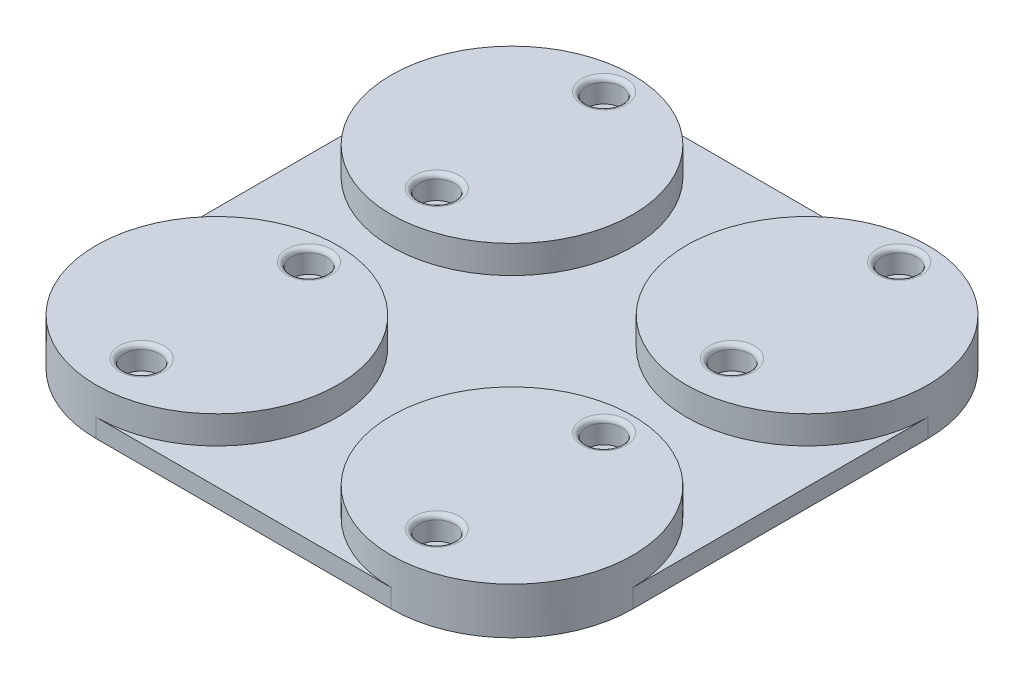
from build123d import *

# Parameters (mm, degrees)
SKETCH1_R           = 13
BOSS_EXTRUDE1_DEPTH = 3
SKETCH2_R           = 1.905
CUT_EXTRUDE1_DEPTH  = 2.5
LPATTERN5_COUNT     = 2
LPATTERN5_PITCH     = 31.75
LPATTERN5_2_COUNT   = 2
LPATTERN5_2_PITCH   = 31.75
BOSS_EXTRUDE2_START = 2
BOSS_EXTRUDE2_DEPTH = 2
SKETCH5_W           = 1.346153846
SKETCH5_H           = 0.358974359
CUT_EXTRUDE2_DEPTH  = 0.25
FILLET1_R           = 0.5


with BuildPart() as part:
    # Sketch1 → Boss-Extrude1 (new body)
    with BuildSketch(Plane(origin=(0, 0, 0), x_dir=(1, 0, 0), z_dir=(0, 1, 0))):
        with Locations(Location((0, 0, 0), (0, 0, 270))):
            Circle(SKETCH1_R)
    extrude(amount=BOSS_EXTRUDE1_DEPTH)

    # Sketch2 → Cut-Extrude1 (cut)
    with BuildSketch(Plane(origin=(0, 3, 0), x_dir=(1, 0, 0), z_dir=(0, 1, 0))):
        with Locations(Location((0, 9.906, 0), (0, 0, 270))):
            Circle(SKETCH2_R)
        with Locations(Location((0, -8.094, 0), (0, 0, 270))):
            Circle(SKETCH2_R)
    extrude(amount=-CUT_EXTRUDE1_DEPTH, mode=Mode.SUBTRACT)


with BuildPart() as lpattern5_1:
    # LPattern5: pattern copy
    add(part.part.moved(Location(Vector(0, 0, 1) * (1 * LPATTERN5_PITCH))))


with BuildPart() as lpattern5_2_1:
    # LPattern5 2: pattern copy
    add(part.part.moved(Location(Vector(1, 0, 0) * (1 * LPATTERN5_2_PITCH))))


with BuildPart() as lpattern5_2_2:
    # LPattern5 2: pattern copy
    add(lpattern5_1.part.moved(Location(Vector(1, 0, 0) * (1 * LPATTERN5_2_PITCH))))


with BuildPart() as part_1:
    add(part.part)

    add(lpattern5_1.part)  # Boss-Extrude2 merges LPattern5_1

    add(lpattern5_2_1.part)  # Boss-Extrude2 merges LPattern5 2_1

    add(lpattern5_2_2.part)  # Boss-Extrude2 merges LPattern5 2_2
    # Sketch3 → Boss-Extrude2 (add)
    with BuildSketch(Plane.XZ.offset(BOSS_EXTRUDE2_START)):
        with BuildLine():
            Line((-13, 0), (-13, 31.75))
            ThreePointArc((-13, 31.75), (-9.192388155, 40.942388155), (0, 44.75))
            Line((0, 44.75), (31.75, 44.75))
            ThreePointArc((31.75, 44.75), (40.942388155, 40.942388155), (44.75, 31.75))
            Line((44.75, 31.75), (44.75, 0))
            ThreePointArc((44.75, 0), (40.942388155, -9.192388155), (31.75, -13))
            Line((31.75, -13), (0, -13))
            ThreePointArc((0, -13), (-9.192388155, -9.192388155), (-13, 0))
        make_face()
    extrude(amount=-BOSS_EXTRUDE2_DEPTH)

    # Sketch5 → Cut-Extrude2 (cut)
    # profile 1 of 16: a face of its own
    with BuildSketch(Plane.XZ.offset(2)):
        with BuildLine():
            Line((0.448717949, 3.5), (1.149138622, 3.5))
            add(Edge.make_bspline(
                [(1.149138622, 3.5), (1.19587975, 3.499844414), (1.285627895, 3.499545672), (1.414201165, 3.497879909), (1.531028262, 3.493105553), (1.636048101, 3.48899697), (1.729258756, 3.481505028), (1.810946047, 3.474344381), (1.880733745, 3.46497072), (1.922979596, 3.456265297), (1.942107372, 3.452323718)],
                knots=[0, 0, 0, 0, 1.410062039, 2.707475311, 3.878576406, 4.937260626, 5.877586885, 6.699081471, 7.410979367, 8, 8, 8, 8], degree=3))
            add(Edge.make_bspline(
                [(1.942107372, 3.452323718), (1.967713996, 3.445996953), (2.018380985, 3.433478389), (2.091331051, 3.407018788), (2.160845375, 3.376399163), (2.2266352, 3.340435443), (2.288370991, 3.298860663), (2.346689302, 3.252392541), (2.401854765, 3.201285335), (2.451636395, 3.144250494), (2.498575447, 3.084413984), (2.538164073, 3.019710227), (2.572290553, 2.9520487), (2.59946107, 2.880741282), (2.621339044, 2.80647951), (2.636765283, 2.728590713), (2.646016471, 2.647429738), (2.646958326, 2.59207183), (2.647435897, 2.564002404)],
                knots=[0, 0, 0, 0, 1.027469482, 2.033020251, 3.019912614, 3.986113645, 4.951240523, 5.91722682, 6.890402269, 7.87763091, 8.8651537, 9.85103654, 10.82876324, 11.815024772, 12.821070561, 13.842952187, 14.906261191, 16, 16, 16, 16], degree=3))
            add(Edge.make_bspline(
                [(2.647435897, 2.564002404), (2.645966899, 2.517367299), (2.643100504, 2.426370131), (2.6163754, 2.29430925), (2.57259888, 2.171119935), (2.512275591, 2.056957297), (2.435456115, 1.954046652), (2.343131324, 1.863656197), (2.235249713, 1.788016284), (2.134820397, 1.735563479), (2.046106197, 1.701970571), (1.973072884, 1.678334212), (1.893405907, 1.660072247), (1.807868572, 1.643712115), (1.716104917, 1.63136042), (1.618334877, 1.622313826), (1.514488726, 1.616659777), (1.443149656, 1.615817772), (1.406450321, 1.615384615)],
                knots=[0, 0, 0, 0, 1.260483769, 2.459530307, 3.627416485, 4.787058657, 5.939039949, 7.08810263, 8.267026773, 9.491475466, 10.141966685, 10.831826277, 11.566392101, 12.351337768, 13.187381173, 14.07005841, 15.007169909, 16, 16, 16, 16], degree=3))
            Line((1.406450321, 1.615384615), (2.692307692, 0))
            Line((2.692307692, 0), (2.303886218, 0))
            Line((2.303886218, 0), (1.018028846, 1.615384615))
            Line((1.018028846, 1.615384615), (0.762820513, 1.615384615))
            Line((0.762820513, 1.615384615), (0.762820513, 0))
            Line((0.762820513, 0), (0.448717949, 0))
            Line((0.448717949, 0), (0.448717949, 3.5))
        make_face()
        with BuildLine():
            Line((0.762820513, 3.141025641), (0.762820513, 1.974358974))
            Line((0.762820513, 1.974358974), (1.403645833, 1.969451122))
            add(Edge.make_bspline(
                [(1.403645833, 1.969451122), (1.433565872, 1.969437885), (1.491559429, 1.969412229), (1.575460094, 1.973406005), (1.653580206, 1.977949323), (1.725620958, 1.984898669), (1.791614533, 1.99385474), (1.851527947, 2.005057725), (1.905458998, 2.018109787), (1.968357537, 2.038311413), (2.038594068, 2.070317431), (2.114925528, 2.11688293), (2.179927866, 2.175452049), (2.234845728, 2.242425505), (2.27897516, 2.316061754), (2.310087214, 2.395478123), (2.329829656, 2.478669721), (2.332158202, 2.535847829), (2.333333333, 2.564703526)],
                knots=[0, 0, 0, 0, 1.146690395, 2.22261258, 3.21895312, 4.145990853, 4.996080663, 5.770904154, 6.481378293, 7.121626537, 8.300444488, 9.431385265, 10.535395872, 11.636531494, 12.74115979, 13.810798291, 14.895190096, 16, 16, 16, 16], degree=3))
            add(Edge.make_bspline(
                [(2.333333333, 2.564703526), (2.332131212, 2.592850099), (2.329749047, 2.648626338), (2.310300278, 2.730282248), (2.277410897, 2.807349198), (2.233088659, 2.879513683), (2.179089504, 2.945019419), (2.115771691, 3.001066572), (2.044866496, 3.047316037), (1.978595298, 3.076870418), (1.919361085, 3.094990271), (1.867931425, 3.107741435), (1.809819948, 3.117985904), (1.744744489, 3.126193964), (1.672982858, 3.133248909), (1.594172207, 3.138000687), (1.508835427, 3.140814551), (1.449688496, 3.14095364), (1.419070513, 3.141025641)],
                knots=[0, 0, 0, 0, 1.101028733, 2.181837193, 3.264309656, 4.369019818, 5.486613113, 6.575447106, 7.666700264, 8.788928104, 9.402425223, 10.0903467, 10.862060571, 11.710948788, 12.657782767, 13.684531032, 14.801375019, 16, 16, 16, 16], degree=3))
            Line((1.419070513, 3.141025641), (0.762820513, 3.141025641))
        make_face(mode=Mode.SUBTRACT)
    # profile 2 of 16: a face of its own
    with BuildSketch(Plane.XZ.offset(2)):
        with BuildLine():
            add(Edge.make_bspline(
                [(4.555889423, 2.602564103), (4.603880696, 2.601542211), (4.697979853, 2.599538533), (4.835787739, 2.578123567), (4.967332875, 2.545376203), (5.093119067, 2.500104641), (5.211535363, 2.43942269), (5.324306607, 2.367013399), (5.431123616, 2.281230805), (5.495146645, 2.214872737), (5.527644231, 2.181189904)],
                knots=[0, 0, 0, 0, 1.054011418, 2.066658804, 3.057071809, 4.030435133, 4.997543892, 5.974964718, 6.972108034, 8, 8, 8, 8], degree=3))
            add(Edge.make_bspline(
                [(5.527644231, 2.181189904), (5.555626185, 2.148975918), (5.611048565, 2.085171376), (5.682114284, 1.981715763), (5.743335844, 1.874575662), (5.792398805, 1.762328336), (5.831083829, 1.645953664), (5.858549525, 1.525051653), (5.87488646, 1.399889306), (5.877089427, 1.314885468), (5.878205128, 1.271834936)],
                knots=[0, 0, 0, 0, 1.025258237, 2.030674902, 3.01204498, 3.988269485, 4.97094183, 5.956517959, 6.965070386, 8, 8, 8, 8], degree=3))
            add(Edge.make_bspline(
                [(5.878205128, 1.271834936), (5.877223791, 1.228534878), (5.875284623, 1.142971945), (5.856941006, 1.016952579), (5.82840992, 0.894757756), (5.787578082, 0.776899063), (5.735219973, 0.663016235), (5.671329285, 0.553606686), (5.595457668, 0.448454553), (5.509453671, 0.348452714), (5.414401795, 0.2562865), (5.311285647, 0.17595823), (5.202131613, 0.107136706), (5.08548826, 0.05170029), (4.962420773, 0.00799059), (4.832663705, -0.022709427), (4.696418635, -0.04127111), (4.603391413, -0.043654684), (4.555889423, -0.044871795)],
                knots=[0, 0, 0, 0, 0.998656419, 1.973391657, 2.932242238, 3.890759089, 4.846373663, 5.82037756, 6.809684879, 7.83454468, 8.860553229, 9.859544525, 10.845671541, 11.83227036, 12.833544569, 13.85385346, 14.904124723, 16, 16, 16, 16], degree=3))
            add(Edge.make_bspline(
                [(4.555889423, -0.044871795), (4.508154704, -0.043650599), (4.414663844, -0.041258824), (4.277937862, -0.022781541), (4.147948243, 0.007976441), (4.024719644, 0.051843934), (3.907574798, 0.107138478), (3.797788301, 0.175750167), (3.694588385, 0.256310322), (3.599516401, 0.348446259), (3.513517795, 0.448456216), (3.437644787, 0.553606254), (3.373754461, 0.663016348), (3.321396257, 0.776899033), (3.280564444, 0.894757764), (3.252033351, 1.016952577), (3.233689737, 1.142971945), (3.231750568, 1.228534878), (3.230769231, 1.271834936)],
                knots=[0, 0, 0, 0, 1.099876186, 2.154163076, 3.173186993, 4.173200201, 5.163417411, 6.152872554, 7.150605724, 8.17532212, 9.198891216, 10.186952605, 11.159729845, 12.11414092, 13.071450619, 14.029093627, 15.002601286, 16, 16, 16, 16], degree=3))
            add(Edge.make_bspline(
                [(3.230769231, 1.271834936), (3.231892541, 1.314651482), (3.234116503, 1.399420884), (3.250437012, 1.524347945), (3.277795568, 1.645045334), (3.316526965, 1.76097081), (3.366042155, 1.872726246), (3.426403443, 1.980131077), (3.498194076, 2.083118877), (3.553396027, 2.146840957), (3.581330128, 2.179086538)],
                knots=[0, 0, 0, 0, 1.031353054, 2.041901799, 3.029428768, 4.008703097, 4.981709435, 5.96992636, 6.972712378, 8, 8, 8, 8], degree=3))
            add(Edge.make_bspline(
                [(3.581330128, 2.179086538), (3.613778719, 2.213061478), (3.677594583, 2.279879174), (3.784943311, 2.365411698), (3.897437132, 2.439327772), (4.017162058, 2.498803987), (4.142844916, 2.545642505), (4.275064159, 2.57820802), (4.413339674, 2.599461375), (4.507899295, 2.601519553), (4.555889423, 2.602564103)],
                knots=[0, 0, 0, 0, 1.027980169, 2.021703884, 2.998553061, 3.971491411, 4.943284454, 5.930300938, 6.949603206, 8, 8, 8, 8], degree=3))
        make_face()
        with BuildLine():
            add(Edge.make_bspline(
                [(4.554487179, 2.288461538), (4.520549568, 2.287496947), (4.453550439, 2.285592664), (4.354930855, 2.27110876), (4.259990701, 2.248161255), (4.168549857, 2.215557199), (4.080916684, 2.1734583), (3.997007282, 2.12174994), (3.916574842, 2.061116984), (3.841192779, 1.991654312), (3.772010466, 1.915775317), (3.71153249, 1.834926959), (3.660107384, 1.750420612), (3.617267225, 1.662168401), (3.585360036, 1.569275987), (3.562187014, 1.472795356), (3.547716774, 1.37252994), (3.545830395, 1.304368921), (3.544871795, 1.269731571)],
                knots=[0, 0, 0, 0, 1.021534396, 2.016698045, 2.994645724, 3.958388632, 4.93408049, 5.916473867, 6.921342795, 7.962252576, 8.998418191, 10.008913653, 10.997312074, 11.973003931, 12.956656626, 13.948281152, 14.957379055, 16, 16, 16, 16], degree=3))
            add(Edge.make_bspline(
                [(3.544871795, 1.269731571), (3.546478619, 1.224979543), (3.549667863, 1.136155138), (3.575603099, 1.005344015), (3.618989379, 0.879762163), (3.677576659, 0.760145777), (3.750982878, 0.649473499), (3.837469944, 0.550802015), (3.936109645, 0.465616203), (4.045726145, 0.394935358), (4.164080463, 0.338775602), (4.289336784, 0.298976626), (4.419977478, 0.273104934), (4.509258209, 0.270533459), (4.554487179, 0.269230769)],
                knots=[0, 0, 0, 0, 1.016792936, 2.018143844, 3.017858371, 4.030088057, 5.03801393, 6.028138512, 7.003788237, 7.991172063, 8.984598303, 9.972568034, 10.972917682, 12, 12, 12, 12], degree=3))
            add(Edge.make_bspline(
                [(4.554487179, 0.269230769), (4.599713548, 0.270541049), (4.688989144, 0.273127506), (4.819448321, 0.298846326), (4.944362293, 0.338949987), (5.062593681, 0.394872197), (5.172160284, 0.465884611), (5.271509405, 0.550320988), (5.357258017, 0.64973484), (5.430591621, 0.760292369), (5.490138364, 0.879576721), (5.533321566, 1.005367193), (5.559319152, 1.136149235), (5.562499981, 1.224977566), (5.564102564, 1.269731571)],
                knots=[0, 0, 0, 0, 1.02726834, 2.027799167, 3.010890988, 4.004497153, 4.992059811, 5.971914811, 6.958719428, 7.966827853, 8.981595046, 9.981490638, 10.983022906, 12, 12, 12, 12], degree=3))
            add(Edge.make_bspline(
                [(5.564102564, 1.269731571), (5.563144294, 1.304369128), (5.561258565, 1.372530554), (5.546783601, 1.472793007), (5.523628061, 1.569284604), (5.491656444, 1.662136607), (5.44900243, 1.750649112), (5.396585637, 1.834678839), (5.336354611, 1.916055385), (5.26633749, 1.991409026), (5.191034113, 2.061144062), (5.110569074, 2.121773452), (5.026784096, 2.173231047), (4.939405513, 2.215917288), (4.847952945, 2.247864628), (4.753145816, 2.271241259), (4.654947006, 2.285531456), (4.588187963, 2.287478598), (4.554487179, 2.288461538)],
                knots=[0, 0, 0, 0, 1.042956736, 2.052379634, 3.044323526, 4.02829302, 5.004299113, 5.996692471, 7.007513377, 8.048758398, 9.090003419, 10.095195979, 11.07790575, 12.047570684, 13.018257071, 13.989683339, 14.985167495, 16, 16, 16, 16], degree=3))
        make_face(mode=Mode.SUBTRACT)
    # profile 3 of 16: a face of its own
    with BuildSketch(Plane.XZ.offset(2)):
        Polygon((6.820512821, 3.58974359), (7.134615385, 3.58974359), (7.134615385, 2.557692308), (7.583333333, 2.557692308), (7.583333333, 2.243589744), (7.134615385, 2.243589744), (7.134615385, 0), (6.820512821, 0), (6.820512821, 2.243589744), (6.371794872, 2.243589744), (6.371794872, 2.557692308), (6.820512821, 2.557692308), align=None)
    # profile 4 of 16: a face of its own
    with BuildSketch(Plane.XZ.offset(2)):
        with BuildLine():
            add(Edge.make_bspline(
                [(9.357171474, 2.602564103), (9.405162747, 2.601542211), (9.499261905, 2.599538533), (9.637069791, 2.578123567), (9.768614927, 2.545376203), (9.894401119, 2.500104641), (10.012817414, 2.43942269), (10.125588658, 2.367013399), (10.232405667, 2.281230805), (10.296428696, 2.214872737), (10.328926282, 2.181189904)],
                knots=[0, 0, 0, 0, 1.054011418, 2.066658804, 3.057071809, 4.030435133, 4.997543892, 5.974964718, 6.972108034, 8, 8, 8, 8], degree=3))
            add(Edge.make_bspline(
                [(10.328926282, 2.181189904), (10.356908236, 2.148975918), (10.412330616, 2.085171376), (10.483396335, 1.981715763), (10.544617895, 1.874575662), (10.593680856, 1.762328336), (10.63236588, 1.645953664), (10.659831576, 1.525051653), (10.676168511, 1.399889306), (10.678371478, 1.314885468), (10.679487179, 1.271834936)],
                knots=[0, 0, 0, 0, 1.025258237, 2.030674902, 3.01204498, 3.988269485, 4.97094183, 5.956517959, 6.965070386, 8, 8, 8, 8], degree=3))
            add(Edge.make_bspline(
                [(10.679487179, 1.271834936), (10.678505842, 1.228534878), (10.676566674, 1.142971945), (10.658223057, 1.016952579), (10.629691972, 0.894757756), (10.588860133, 0.776899063), (10.536502024, 0.663016235), (10.472611337, 0.553606686), (10.396739719, 0.448454553), (10.310735723, 0.348452714), (10.215683847, 0.2562865), (10.112567698, 0.17595823), (10.003413664, 0.107136706), (9.886770311, 0.05170029), (9.763702824, 0.00799059), (9.633945756, -0.022709427), (9.497700686, -0.04127111), (9.404673465, -0.043654684), (9.357171474, -0.044871795)],
                knots=[0, 0, 0, 0, 0.998656419, 1.973391657, 2.932242238, 3.890759089, 4.846373663, 5.82037756, 6.809684879, 7.83454468, 8.860553229, 9.859544525, 10.845671541, 11.83227036, 12.833544569, 13.85385346, 14.904124723, 16, 16, 16, 16], degree=3))
            add(Edge.make_bspline(
                [(9.357171474, -0.044871795), (9.309436755, -0.043650599), (9.215945895, -0.041258824), (9.079219913, -0.022781541), (8.949230294, 0.007976441), (8.826001696, 0.051843934), (8.708856849, 0.107138478), (8.599070352, 0.175750167), (8.495870436, 0.256310322), (8.400798452, 0.348446259), (8.314799847, 0.448456216), (8.238926838, 0.553606254), (8.175036512, 0.663016348), (8.122678308, 0.776899033), (8.081846495, 0.894757764), (8.053315403, 1.016952577), (8.034971788, 1.142971945), (8.033032619, 1.228534878), (8.032051282, 1.271834936)],
                knots=[0, 0, 0, 0, 1.099876186, 2.154163076, 3.173186993, 4.173200201, 5.163417411, 6.152872554, 7.150605724, 8.17532212, 9.198891216, 10.186952605, 11.159729845, 12.11414092, 13.071450619, 14.029093627, 15.002601286, 16, 16, 16, 16], degree=3))
            add(Edge.make_bspline(
                [(8.032051282, 1.271834936), (8.033174592, 1.314651482), (8.035398554, 1.399420884), (8.051719063, 1.524347945), (8.079077619, 1.645045334), (8.117809016, 1.76097081), (8.167324207, 1.872726246), (8.227685495, 1.980131077), (8.299476127, 2.083118877), (8.354678079, 2.146840957), (8.382612179, 2.179086538)],
                knots=[0, 0, 0, 0, 1.031353054, 2.041901799, 3.029428768, 4.008703097, 4.981709435, 5.96992636, 6.972712378, 8, 8, 8, 8], degree=3))
            add(Edge.make_bspline(
                [(8.382612179, 2.179086538), (8.415060771, 2.213061478), (8.478876634, 2.279879174), (8.586225362, 2.365411698), (8.698719183, 2.439327772), (8.818444109, 2.498803987), (8.944126967, 2.545642505), (9.07634621, 2.57820802), (9.214621725, 2.599461375), (9.309181346, 2.601519553), (9.357171474, 2.602564103)],
                knots=[0, 0, 0, 0, 1.027980169, 2.021703884, 2.998553061, 3.971491411, 4.943284454, 5.930300938, 6.949603206, 8, 8, 8, 8], degree=3))
        make_face()
        with BuildLine():
            add(Edge.make_bspline(
                [(9.355769231, 2.288461538), (9.321831619, 2.287496947), (9.254832491, 2.285592664), (9.156212906, 2.27110876), (9.061272752, 2.248161255), (8.969831908, 2.215557199), (8.882198736, 2.1734583), (8.798289333, 2.12174994), (8.717856893, 2.061116984), (8.64247483, 1.991654312), (8.573292518, 1.915775317), (8.512814541, 1.834926959), (8.461389435, 1.750420612), (8.418549276, 1.662168401), (8.386642088, 1.569275987), (8.363469065, 1.472795356), (8.348998825, 1.37252994), (8.347112446, 1.304368921), (8.346153846, 1.269731571)],
                knots=[0, 0, 0, 0, 1.021534396, 2.016698045, 2.994645724, 3.958388632, 4.93408049, 5.916473867, 6.921342795, 7.962252576, 8.998418191, 10.008913653, 10.997312074, 11.973003931, 12.956656626, 13.948281152, 14.957379055, 16, 16, 16, 16], degree=3))
            add(Edge.make_bspline(
                [(8.346153846, 1.269731571), (8.34776067, 1.224979543), (8.350949914, 1.136155138), (8.376885151, 1.005344015), (8.420271431, 0.879762163), (8.47885871, 0.760145777), (8.552264929, 0.649473499), (8.638751996, 0.550802015), (8.737391696, 0.465616203), (8.847008196, 0.394935358), (8.965362514, 0.338775602), (9.090618835, 0.298976626), (9.221259529, 0.273104934), (9.31054026, 0.270533459), (9.355769231, 0.269230769)],
                knots=[0, 0, 0, 0, 1.016792936, 2.018143844, 3.017858371, 4.030088057, 5.03801393, 6.028138512, 7.003788237, 7.991172063, 8.984598303, 9.972568034, 10.972917682, 12, 12, 12, 12], degree=3))
            add(Edge.make_bspline(
                [(9.355769231, 0.269230769), (9.4009956, 0.270541049), (9.490271196, 0.273127506), (9.620730373, 0.298846326), (9.745644344, 0.338949987), (9.863875732, 0.394872197), (9.973442335, 0.465884611), (10.072791457, 0.550320988), (10.158540068, 0.64973484), (10.231873673, 0.760292369), (10.291420415, 0.879576721), (10.334603617, 1.005367193), (10.360601203, 1.136149235), (10.363782032, 1.224977566), (10.365384615, 1.269731571)],
                knots=[0, 0, 0, 0, 1.02726834, 2.027799167, 3.010890988, 4.004497153, 4.992059811, 5.971914811, 6.958719428, 7.966827853, 8.981595046, 9.981490638, 10.983022906, 12, 12, 12, 12], degree=3))
            add(Edge.make_bspline(
                [(10.365384615, 1.269731571), (10.364426345, 1.304369128), (10.362540616, 1.372530554), (10.348065652, 1.472793007), (10.324910112, 1.569284604), (10.292938495, 1.662136607), (10.250284481, 1.750649112), (10.197867688, 1.834678839), (10.137636663, 1.916055385), (10.067619542, 1.991409026), (9.992316164, 2.061144062), (9.911851126, 2.121773452), (9.828066147, 2.173231047), (9.740687564, 2.215917288), (9.649234997, 2.247864628), (9.554427868, 2.271241259), (9.456229058, 2.285531456), (9.389470014, 2.287478598), (9.355769231, 2.288461538)],
                knots=[0, 0, 0, 0, 1.042956736, 2.052379634, 3.044323526, 4.02829302, 5.004299113, 5.996692471, 7.007513377, 8.048758398, 9.090003419, 10.095195979, 11.07790575, 12.047570684, 13.018257071, 13.989683339, 14.985167495, 16, 16, 16, 16], degree=3))
        make_face(mode=Mode.SUBTRACT)
    # profile 5 of 16: a face of its own
    with BuildSketch(Plane.XZ.offset(2)):
        with Locations((11.756410256, 1.346153847)):
            Rectangle(SKETCH5_W, SKETCH5_H)
    # profile 6 of 16: a face of its own
    with BuildSketch(Plane.XZ.offset(2)):
        Polygon((13.012820513, 3.5), (13.326923077, 3.5), (13.326923077, 0.358974359), (14.673076923, 0.358974359), (14.673076923, 0), (13.012820513, 0), align=None)
    # profile 7 of 16: a face of its own
    with BuildSketch(Plane.XZ.offset(2)):
        with BuildLine():
            add(Edge.make_bspline(
                [(16.402043269, 2.602564103), (16.450034542, 2.601542211), (16.5441337, 2.599538533), (16.681941586, 2.578123567), (16.813486721, 2.545376203), (16.939272914, 2.500104641), (17.057689209, 2.43942269), (17.170460453, 2.367013399), (17.277277462, 2.281230805), (17.341300491, 2.214872737), (17.373798077, 2.181189904)],
                knots=[0, 0, 0, 0, 1.054011418, 2.066658804, 3.057071809, 4.030435133, 4.997543892, 5.974964718, 6.972108034, 8, 8, 8, 8], degree=3))
            add(Edge.make_bspline(
                [(17.373798077, 2.181189904), (17.401780031, 2.148975918), (17.457202411, 2.085171376), (17.52826813, 1.981715763), (17.58948969, 1.874575662), (17.638552651, 1.762328336), (17.677237675, 1.645953664), (17.704703371, 1.525051653), (17.721040306, 1.399889306), (17.723243273, 1.314885468), (17.724358974, 1.271834936)],
                knots=[0, 0, 0, 0, 1.025258237, 2.030674902, 3.01204498, 3.988269485, 4.97094183, 5.956517959, 6.965070386, 8, 8, 8, 8], degree=3))
            add(Edge.make_bspline(
                [(17.724358974, 1.271834936), (17.723377637, 1.228534878), (17.721438469, 1.142971945), (17.703094852, 1.016952579), (17.674563766, 0.894757756), (17.633731928, 0.776899063), (17.581373819, 0.663016235), (17.517483131, 0.553606686), (17.441611514, 0.448454553), (17.355607518, 0.348452714), (17.260555641, 0.2562865), (17.157439493, 0.17595823), (17.048285459, 0.107136706), (16.931642106, 0.05170029), (16.808574619, 0.00799059), (16.678817551, -0.022709427), (16.542572481, -0.04127111), (16.449545259, -0.043654684), (16.402043269, -0.044871795)],
                knots=[0, 0, 0, 0, 0.998656419, 1.973391657, 2.932242238, 3.890759089, 4.846373663, 5.82037756, 6.809684879, 7.83454468, 8.860553229, 9.859544525, 10.845671541, 11.83227036, 12.833544569, 13.85385346, 14.904124723, 16, 16, 16, 16], degree=3))
            add(Edge.make_bspline(
                [(16.402043269, -0.044871795), (16.35430855, -0.043650599), (16.26081769, -0.041258824), (16.124091708, -0.022781541), (15.994102089, 0.007976441), (15.870873491, 0.051843934), (15.753728644, 0.107138478), (15.643942147, 0.175750167), (15.540742231, 0.256310322), (15.445670247, 0.348446259), (15.359671641, 0.448456216), (15.283798633, 0.553606254), (15.219908307, 0.663016348), (15.167550103, 0.776899033), (15.12671829, 0.894757764), (15.098187197, 1.016952577), (15.079843583, 1.142971945), (15.077904414, 1.228534878), (15.076923077, 1.271834936)],
                knots=[0, 0, 0, 0, 1.099876186, 2.154163076, 3.173186993, 4.173200201, 5.163417411, 6.152872554, 7.150605724, 8.17532212, 9.198891216, 10.186952605, 11.159729845, 12.11414092, 13.071450619, 14.029093627, 15.002601286, 16, 16, 16, 16], degree=3))
            add(Edge.make_bspline(
                [(15.076923077, 1.271834936), (15.078046387, 1.314651482), (15.080270349, 1.399420884), (15.096590858, 1.524347945), (15.123949414, 1.645045334), (15.162680811, 1.76097081), (15.212196002, 1.872726246), (15.27255729, 1.980131077), (15.344347922, 2.083118877), (15.399549874, 2.146840957), (15.427483974, 2.179086538)],
                knots=[0, 0, 0, 0, 1.031353054, 2.041901799, 3.029428768, 4.008703097, 4.981709435, 5.96992636, 6.972712378, 8, 8, 8, 8], degree=3))
            add(Edge.make_bspline(
                [(15.427483974, 2.179086538), (15.459932565, 2.213061478), (15.523748429, 2.279879174), (15.631097157, 2.365411698), (15.743590978, 2.439327772), (15.863315904, 2.498803987), (15.988998762, 2.545642505), (16.121218005, 2.57820802), (16.25949352, 2.599461375), (16.354053141, 2.601519553), (16.402043269, 2.602564103)],
                knots=[0, 0, 0, 0, 1.027980169, 2.021703884, 2.998553061, 3.971491411, 4.943284454, 5.930300938, 6.949603206, 8, 8, 8, 8], degree=3))
        make_face()
        with BuildLine():
            add(Edge.make_bspline(
                [(16.400641026, 2.288461538), (16.366703414, 2.287496947), (16.299704286, 2.285592664), (16.201084701, 2.27110876), (16.106144547, 2.248161255), (16.014703703, 2.215557199), (15.92707053, 2.1734583), (15.843161128, 2.12174994), (15.762728688, 2.061116984), (15.687346625, 1.991654312), (15.618164313, 1.915775317), (15.557686336, 1.834926959), (15.50626123, 1.750420612), (15.463421071, 1.662168401), (15.431513883, 1.569275987), (15.40834086, 1.472795356), (15.39387062, 1.37252994), (15.391984241, 1.304368921), (15.391025641, 1.269731571)],
                knots=[0, 0, 0, 0, 1.021534396, 2.016698045, 2.994645724, 3.958388632, 4.93408049, 5.916473867, 6.921342795, 7.962252576, 8.998418191, 10.008913653, 10.997312074, 11.973003931, 12.956656626, 13.948281152, 14.957379055, 16, 16, 16, 16], degree=3))
            add(Edge.make_bspline(
                [(15.391025641, 1.269731571), (15.392632465, 1.224979543), (15.395821709, 1.136155138), (15.421756946, 1.005344015), (15.465143225, 0.879762163), (15.523730505, 0.760145777), (15.597136724, 0.649473499), (15.68362379, 0.550802015), (15.782263491, 0.465616203), (15.891879991, 0.394935358), (16.010234309, 0.338775602), (16.13549063, 0.298976626), (16.266131324, 0.273104934), (16.355412055, 0.270533459), (16.400641026, 0.269230769)],
                knots=[0, 0, 0, 0, 1.016792936, 2.018143844, 3.017858371, 4.030088057, 5.03801393, 6.028138512, 7.003788237, 7.991172063, 8.984598303, 9.972568034, 10.972917682, 12, 12, 12, 12], degree=3))
            add(Edge.make_bspline(
                [(16.400641026, 0.269230769), (16.445867395, 0.270541049), (16.535142991, 0.273127506), (16.665602167, 0.298846326), (16.790516139, 0.338949987), (16.908747527, 0.394872197), (17.01831413, 0.465884611), (17.117663252, 0.550320988), (17.203411863, 0.64973484), (17.276745468, 0.760292369), (17.33629221, 0.879576721), (17.379475412, 1.005367193), (17.405472998, 1.136149235), (17.408653827, 1.224977566), (17.41025641, 1.269731571)],
                knots=[0, 0, 0, 0, 1.02726834, 2.027799167, 3.010890988, 4.004497153, 4.992059811, 5.971914811, 6.958719428, 7.966827853, 8.981595046, 9.981490638, 10.983022906, 12, 12, 12, 12], degree=3))
            add(Edge.make_bspline(
                [(17.41025641, 1.269731571), (17.40929814, 1.304369128), (17.407412411, 1.372530554), (17.392937447, 1.472793007), (17.369781907, 1.569284604), (17.33781029, 1.662136607), (17.295156276, 1.750649112), (17.242739483, 1.834678839), (17.182508457, 1.916055385), (17.112491337, 1.991409026), (17.037187959, 2.061144062), (16.956722921, 2.121773452), (16.872937942, 2.173231047), (16.785559359, 2.215917288), (16.694106792, 2.247864628), (16.599299662, 2.271241259), (16.501100853, 2.285531456), (16.434341809, 2.287478598), (16.400641026, 2.288461538)],
                knots=[0, 0, 0, 0, 1.042956736, 2.052379634, 3.044323526, 4.02829302, 5.004299113, 5.996692471, 7.007513377, 8.048758398, 9.090003419, 10.095195979, 11.07790575, 12.047570684, 13.018257071, 13.989683339, 14.985167495, 16, 16, 16, 16], degree=3))
        make_face(mode=Mode.SUBTRACT)
    # profile 8 of 16: a face of its own
    with BuildSketch(Plane.XZ.offset(2)):
        with BuildLine():
            Line((20.865384615, 2.003104968), (20.602463942, 1.83974359))
            add(Edge.make_bspline(
                [(20.602463942, 1.83974359), (20.573634077, 1.875571984), (20.516887382, 1.946094094), (20.418348145, 2.037104027), (20.313336731, 2.115271069), (20.200058683, 2.17897482), (20.078672883, 2.22819627), (19.949658032, 2.263026476), (19.813032527, 2.284730719), (19.719367328, 2.287197555), (19.671374199, 2.288461538)],
                knots=[0, 0, 0, 0, 1.026593902, 2.0206758, 2.988051866, 3.946915611, 4.916868779, 5.907761954, 6.927957743, 8, 8, 8, 8], degree=3))
            add(Edge.make_bspline(
                [(19.671374199, 2.288461538), (19.633015242, 2.287404696), (19.557468319, 2.285323274), (19.446562166, 2.272312781), (19.340919813, 2.248670773), (19.239879104, 2.217519816), (19.144158685, 2.175769526), (19.053507767, 2.12495977), (18.967122277, 2.06590973), (18.887505535, 1.997499184), (18.814676528, 1.923100516), (18.751577614, 1.843346821), (18.696640681, 1.76062693), (18.653534725, 1.672875188), (18.618259554, 1.582099134), (18.595052834, 1.486585279), (18.579588139, 1.387557271), (18.57781881, 1.320038931), (18.576923077, 1.285857372)],
                knots=[0, 0, 0, 0, 1.112346261, 2.190735716, 3.231507886, 4.247384806, 5.251966152, 6.253067467, 7.256802811, 8.280671706, 9.291813951, 10.270744147, 11.225547591, 12.165006084, 13.100104208, 14.043489273, 15.009504848, 16, 16, 16, 16], degree=3))
            add(Edge.make_bspline(
                [(18.576923077, 1.285857372), (18.578702329, 1.241088161), (18.58223686, 1.152152965), (18.609938319, 1.020874863), (18.655282727, 0.893951173), (18.717340577, 0.772283036), (18.795817712, 0.65968888), (18.887990275, 0.558705426), (18.993909358, 0.471289398), (19.112641689, 0.398816873), (19.241399433, 0.340555505), (19.378789537, 0.299048172), (19.523689318, 0.2739958), (19.622896065, 0.270839857), (19.673477564, 0.269230769)],
                knots=[0, 0, 0, 0, 0.966302908, 1.919585723, 2.883856336, 3.870342332, 4.860282998, 5.839159637, 6.814385684, 7.815993281, 8.834850808, 9.858348828, 10.908058873, 12, 12, 12, 12], degree=3))
            add(Edge.make_bspline(
                [(19.673477564, 0.269230769), (19.719832748, 0.270530266), (19.810932987, 0.273084123), (19.944100272, 0.294613087), (20.070880183, 0.32985672), (20.191268213, 0.37900437), (20.305044379, 0.442531886), (20.411473554, 0.520891057), (20.512673493, 0.611827657), (20.572170469, 0.682145629), (20.602463942, 0.717948718)],
                knots=[0, 0, 0, 0, 1.039848629, 2.043578496, 3.018386758, 3.987534228, 4.954977003, 5.934852016, 6.948509513, 8, 8, 8, 8], degree=3))
            Line((20.602463942, 0.717948718), (20.865384615, 0.545472756))
            add(Edge.make_bspline(
                [(20.865384615, 0.545472756), (20.849796913, 0.522582029), (20.818673246, 0.476876553), (20.766645621, 0.412432436), (20.710525789, 0.352110754), (20.650532692, 0.295992364), (20.587449682, 0.242734345), (20.519121773, 0.19488277), (20.447752161, 0.149747947), (20.372503004, 0.109135075), (20.294152306, 0.072628754), (20.212810316, 0.041237583), (20.128830503, 0.014267477), (20.042114127, -0.00716987), (19.952490229, -0.024280708), (19.860190594, -0.03563441), (19.765247013, -0.044109691), (19.701074861, -0.044615558), (19.668569712, -0.044871795)],
                knots=[0, 0, 0, 0, 0.954134338, 1.905101784, 2.851144739, 3.791306361, 4.734911809, 5.6936923, 6.663572882, 7.643865596, 8.638447847, 9.640600242, 10.646758161, 11.676244097, 12.717260333, 13.78922464, 14.880174919, 16, 16, 16, 16], degree=3))
            add(Edge.make_bspline(
                [(19.668569712, -0.044871795), (19.618958828, -0.043980515), (19.521721136, -0.0422336), (19.379398628, -0.023025125), (19.243384961, 0.005932491), (19.113726603, 0.047496225), (18.990403369, 0.101001001), (18.87353025, 0.166357915), (18.763494232, 0.244109705), (18.66138345, 0.332872475), (18.567602003, 0.429113115), (18.487075813, 0.532963033), (18.417230542, 0.640604081), (18.361142999, 0.754413607), (18.316496073, 0.87287898), (18.28599124, 0.99694922), (18.266261503, 1.125601474), (18.263978123, 1.213334356), (18.262820513, 1.2578125)],
                knots=[0, 0, 0, 0, 1.1129367, 2.181364009, 3.217532258, 4.231199276, 5.232079859, 6.230262199, 7.231623845, 8.250719726, 9.263571943, 10.242672461, 11.195837495, 12.138959767, 13.085126421, 14.0317438, 15.002148558, 16, 16, 16, 16], degree=3))
            add(Edge.make_bspline(
                [(18.262820513, 1.2578125), (18.263261529, 1.287990935), (18.264138783, 1.348020822), (18.274200711, 1.437115889), (18.287199184, 1.525024434), (18.309224921, 1.610632153), (18.334665552, 1.695237443), (18.367141084, 1.777820545), (18.405236479, 1.858765217), (18.448488426, 1.937862947), (18.497177171, 2.013812487), (18.551058405, 2.085566151), (18.608102741, 2.153985917), (18.670978853, 2.216709677), (18.737018507, 2.276245869), (18.808090082, 2.331003993), (18.883785934, 2.381144984), (18.962969257, 2.427595999), (19.045593968, 2.468955434), (19.131160638, 2.504588672), (19.219153668, 2.535041248), (19.309713812, 2.559150167), (19.402239985, 2.579367591), (19.497461323, 2.592085437), (19.595013545, 2.60107171), (19.661069568, 2.602062502), (19.694511218, 2.602564103)],
                knots=[0, 0, 0, 0, 0.990994727, 1.971252077, 2.943264845, 3.907940874, 4.872158414, 5.844625996, 6.82015047, 7.809835459, 8.804511986, 9.781214284, 10.756496977, 11.728388426, 12.696359165, 13.676225489, 14.672885716, 15.677705647, 16.690706858, 17.706033469, 18.721040654, 19.747369689, 20.783475414, 21.830280724, 22.901553713, 24, 24, 24, 24], degree=3))
            add(Edge.make_bspline(
                [(19.694511218, 2.602564103), (19.736391326, 2.601642212), (19.819942206, 2.599803037), (19.943882912, 2.584324385), (20.065998106, 2.560987969), (20.18414521, 2.526415139), (20.296891724, 2.484551483), (20.402427174, 2.437538769), (20.498267278, 2.382944165), (20.586194867, 2.323224051), (20.666374385, 2.255863145), (20.739628877, 2.180056188), (20.807460526, 2.096197709), (20.845917238, 2.034391978), (20.865384615, 2.003104968)],
                knots=[0, 0, 0, 0, 1.095225653, 2.184976855, 3.262915854, 4.344593502, 5.400796181, 6.407717688, 7.363229445, 8.282371371, 9.184954523, 10.097238608, 11.036792983, 12, 12, 12, 12], degree=3))
        make_face()
    # profile 9 of 16: a face of its own
    with BuildSketch(Plane.XZ.offset(2)):
        Polygon((21.493589744, 3.58974359), (21.807692308, 3.58974359), (21.807692308, 1.514423077), (22.972255609, 2.557692308), (23.423076923, 2.557692308), (22.072716346, 1.346153846), (23.557692308, 0), (23.106870994, 0), (21.807692308, 1.178585737), (21.807692308, 0), (21.493589744, 0), align=None)
    # profile 10 of 16: a face of its own
    with BuildSketch(Plane.XZ.offset(2)):
        with Locations((24.365384615, 1.346153847)):
            Rectangle(SKETCH5_W, SKETCH5_H)
    # profile 11 of 16: a face of its own
    with BuildSketch(Plane.XZ.offset(2)):
        with BuildLine():
            Line((28.897435897, 2.902644231), (28.628205128, 2.647435897))
            add(Edge.make_bspline(
                [(28.628205128, 2.647435897), (28.57948624, 2.69326676), (28.483210194, 2.783835623), (28.326249951, 2.901346619), (28.162486317, 3.002012719), (27.99277382, 3.083918955), (27.821315266, 3.149271716), (27.65038649, 3.195799856), (27.481740789, 3.225472393), (27.36957357, 3.229020763), (27.314302885, 3.230769231)],
                knots=[0, 0, 0, 0, 1.08915593, 2.152340314, 3.188132944, 4.216796309, 5.218260357, 6.173443236, 7.099959455, 8, 8, 8, 8], degree=3))
            add(Edge.make_bspline(
                [(27.314302885, 3.230769231), (27.280388185, 3.230355625), (27.212646744, 3.229529486), (27.1120248, 3.218985271), (27.012458163, 3.203820406), (26.914134788, 3.181878529), (26.816863502, 3.154069469), (26.72098261, 3.119284006), (26.626313255, 3.078728762), (26.533747174, 3.031866288), (26.44400667, 2.980386442), (26.359249835, 2.923337901), (26.278936436, 2.862549111), (26.20457601, 2.796498132), (26.135740824, 2.725783266), (26.070792452, 2.65171996), (26.012015156, 2.572284742), (25.958923991, 2.488939116), (25.911562373, 2.403146926), (25.869753719, 2.315733937), (25.834656631, 2.226990082), (25.806887176, 2.136804005), (25.783976522, 2.045873415), (25.767858915, 1.953568694), (25.758772192, 1.859791009), (25.757200412, 1.79699375), (25.756410256, 1.765424679)],
                knots=[0, 0, 0, 0, 1.02818874, 2.053710826, 3.065248034, 4.081641283, 5.106893873, 6.131558223, 7.173050175, 8.228653731, 9.27666206, 10.308777013, 11.325269123, 12.329503258, 13.32196095, 14.316845687, 15.314881793, 16.315733098, 17.311955233, 18.285320748, 19.252783886, 20.203351036, 21.145449891, 22.095197417, 23.042428769, 24, 24, 24, 24], degree=3))
            add(Edge.make_bspline(
                [(25.756410256, 1.765424679), (25.757165975, 1.733153862), (25.758675348, 1.668700349), (25.768335667, 1.572506276), (25.786263908, 1.477740874), (25.810231616, 1.384092741), (25.840212432, 1.291401493), (25.877585098, 1.200068983), (25.921850699, 1.110098592), (25.973087251, 1.022300975), (26.029273454, 0.936777951), (26.092216535, 0.85621843), (26.159077119, 0.779549652), (26.232291019, 0.708473889), (26.309510561, 0.641089992), (26.393042837, 0.57925447), (26.481245297, 0.521776247), (26.574252509, 0.469379728), (26.671055292, 0.422571192), (26.770312045, 0.380947296), (26.87233986, 0.346667959), (26.97660255, 0.318729855), (27.082975822, 0.295829557), (27.191999624, 0.281097077), (27.302872333, 0.270406246), (27.377610965, 0.269624576), (27.415264423, 0.269230769)],
                knots=[0, 0, 0, 0, 0.93586088, 1.869166235, 2.799637598, 3.729985548, 4.670839027, 5.622275134, 6.589130586, 7.576015415, 8.568469353, 9.55398029, 10.53834874, 11.515998671, 12.510579167, 13.508179873, 14.527009472, 15.561807829, 16.601455013, 17.643573243, 18.680854198, 19.719860599, 20.772568776, 21.833555941, 22.908541556, 24, 24, 24, 24], degree=3))
            add(Edge.make_bspline(
                [(27.415264423, 0.269230769), (27.46064277, 0.270179346), (27.549750528, 0.272042029), (27.68073697, 0.286542319), (27.806540041, 0.309189112), (27.926806244, 0.342355009), (28.041675265, 0.384658684), (28.151568206, 0.43565407), (28.255619865, 0.49729713), (28.354143038, 0.566870997), (28.444900224, 0.644385829), (28.526754348, 0.728030284), (28.598399837, 0.817398351), (28.660904537, 0.911963666), (28.712613191, 1.012508971), (28.755055986, 1.118541534), (28.787589278, 1.230109046), (28.800944252, 1.307200677), (28.807692308, 1.346153846)],
                knots=[0, 0, 0, 0, 1.13008108, 2.219097802, 3.278683437, 4.311054135, 5.322181354, 6.324827112, 7.324222904, 8.330512327, 9.32562643, 10.293043162, 11.24128371, 12.174520618, 13.111833804, 14.052305215, 15.015860969, 16, 16, 16, 16], degree=3))
            Line((28.807692308, 1.346153846), (27.641025641, 1.346153846))
            Line((27.641025641, 1.346153846), (27.641025641, 1.705128205))
            Line((27.641025641, 1.705128205), (29.121794872, 1.705128205))
            add(Edge.make_bspline(
                [(29.121794872, 1.705128205), (29.120089023, 1.638220716), (29.11675037, 1.507270675), (29.093331454, 1.316300404), (29.055514942, 1.13592871), (29.00385463, 0.965965639), (28.93697935, 0.806652046), (28.855606821, 0.65782618), (28.7584347, 0.520449499), (28.648924259, 0.393400495), (28.526024301, 0.280071283), (28.393055681, 0.180465345), (28.249798713, 0.09656273), (28.096388905, 0.028302067), (27.933328472, -0.024971927), (27.760240092, -0.062743504), (27.577358491, -0.085373467), (27.452021814, -0.088264847), (27.387920673, -0.08974359)],
                knots=[0, 0, 0, 0, 1.140356446, 2.231883559, 3.274166699, 4.278491846, 5.25512956, 6.21435461, 7.1637429, 8.11826594, 9.068280886, 10.0076534, 10.945064095, 11.891975133, 12.864533718, 13.863980011, 14.907571808, 16, 16, 16, 16], degree=3))
            add(Edge.make_bspline(
                [(27.387920673, -0.08974359), (27.348410538, -0.089174469), (27.270483817, -0.088051978), (27.155392889, -0.080074631), (27.043475268, -0.067794054), (26.934747259, -0.049248931), (26.828808917, -0.026534277), (26.726189332, 0.002552442), (26.62649759, 0.036221141), (26.529579605, 0.074516815), (26.436315058, 0.118888472), (26.346288541, 0.168198111), (26.259002415, 0.222191472), (26.17505125, 0.281802318), (26.093997629, 0.346584778), (26.016364185, 0.416668697), (25.941716307, 0.491839816), (25.894955843, 0.545218826), (25.871394231, 0.572115385)],
                knots=[0, 0, 0, 0, 1.107784379, 2.184907829, 3.233506516, 4.263428166, 5.276301166, 6.270063455, 7.25232949, 8.225834625, 9.190232166, 10.146266622, 11.1027726, 12.066435141, 13.031522626, 14.010570082, 14.99756817, 16, 16, 16, 16], degree=3))
            add(Edge.make_bspline(
                [(25.871394231, 0.572115385), (25.837208299, 0.614786038), (25.769403886, 0.699419055), (25.68212573, 0.835018999), (25.607724327, 0.975420859), (25.547356505, 1.121015488), (25.500218418, 1.271666701), (25.466412166, 1.427181992), (25.446604876, 1.587761622), (25.443751339, 1.696426887), (25.442307692, 1.751402244)],
                knots=[0, 0, 0, 0, 1.023165419, 2.029347347, 3.013907458, 3.994755782, 4.975994455, 5.96558838, 6.970761222, 8, 8, 8, 8], degree=3))
            add(Edge.make_bspline(
                [(25.442307692, 1.751402244), (25.44283993, 1.792568496), (25.443897642, 1.874377804), (25.456723158, 1.995835111), (25.475124576, 2.115135803), (25.502171631, 2.23218236), (25.536267896, 2.347052951), (25.578821382, 2.459800915), (25.628366278, 2.570492787), (25.685951774, 2.678366655), (25.750036233, 2.781991068), (25.819586454, 2.880948871), (25.895590054, 2.973437936), (25.976805853, 3.060629584), (26.064202844, 3.141428431), (26.156962267, 3.216582542), (26.25515561, 3.286192728), (26.35909179, 3.349162562), (26.467219475, 3.405726183), (26.579279476, 3.455315395), (26.695237587, 3.49629871), (26.814225065, 3.53107249), (26.937142565, 3.55678763), (27.063098102, 3.575436376), (27.192748214, 3.588196975), (27.280384244, 3.589223231), (27.324819712, 3.58974359)],
                knots=[0, 0, 0, 0, 1.008945113, 2.00506715, 2.99143336, 3.967273523, 4.948097931, 5.927297278, 6.919902385, 7.919676788, 8.923139349, 9.905703106, 10.883022732, 11.856032218, 12.825136022, 13.798837087, 14.781400844, 15.773989409, 16.776158564, 17.77167057, 18.775803737, 19.789618931, 20.80898985, 21.851988756, 22.910860228, 24, 24, 24, 24], degree=3))
            add(Edge.make_bspline(
                [(27.324819712, 3.58974359), (27.361057955, 3.589164098), (27.432914134, 3.588015034), (27.539839866, 3.580050386), (27.645112881, 3.567426505), (27.748889271, 3.550199718), (27.850815637, 3.526736028), (27.951182342, 3.498657743), (28.050134879, 3.46596592), (28.147363128, 3.426977074), (28.243520844, 3.382723449), (28.339142684, 3.332910027), (28.43390193, 3.276685022), (28.527962912, 3.213881487), (28.62191877, 3.145578069), (28.714283412, 3.069821245), (28.807286356, 2.989598489), (28.86708817, 2.931916305), (28.897435897, 2.902644231)],
                knots=[0, 0, 0, 0, 0.985871117, 1.954866573, 2.915460327, 3.869826059, 4.81536089, 5.759505086, 6.70452669, 7.649098992, 8.607881297, 9.583363685, 10.581137262, 11.603961102, 12.659522466, 13.73993555, 14.853081303, 16, 16, 16, 16], degree=3))
        make_face()
    # profile 12 of 16: a face of its own
    with BuildSketch(Plane.XZ.offset(2)):
        with BuildLine():
            Line((29.83974359, 3.5), (30.522636218, 3.5))
            add(Edge.make_bspline(
                [(30.522636218, 3.5), (30.556064696, 3.49982425), (30.620857406, 3.499483602), (30.715076848, 3.49420047), (30.803325659, 3.486996801), (30.885629431, 3.475566708), (30.961950134, 3.461774931), (31.032517771, 3.445073115), (31.097107943, 3.425046501), (31.17422068, 3.39320022), (31.26214134, 3.345877051), (31.357339733, 3.275948486), (31.438743973, 3.190416023), (31.50893029, 3.093933368), (31.564731409, 2.987797596), (31.605100707, 2.874538407), (31.630658582, 2.755616665), (31.633287016, 2.673973487), (31.634615385, 2.63271234)],
                knots=[0, 0, 0, 0, 1.001505555, 1.941167018, 2.826882275, 3.653841531, 4.429895133, 5.150066043, 5.825578002, 6.45369114, 7.647487171, 8.808567382, 9.977351308, 11.170798116, 12.373658725, 13.556498008, 14.765093433, 16, 16, 16, 16], degree=3))
            add(Edge.make_bspline(
                [(31.634615385, 2.63271234), (31.633522166, 2.594059784), (31.631373889, 2.518103867), (31.61083113, 2.407009758), (31.578670461, 2.301258539), (31.533965212, 2.201236154), (31.475863216, 2.10920254), (31.407004897, 2.024415274), (31.323928095, 1.950464217), (31.261684855, 1.909121315), (31.230068109, 1.888120994)],
                knots=[0, 0, 0, 0, 1.044552857, 2.05264487, 3.044412934, 4.028983338, 5.005914585, 5.980388656, 6.974128949, 8, 8, 8, 8], degree=3))
            add(Edge.make_bspline(
                [(31.230068109, 1.888120994), (31.269828537, 1.872855995), (31.345900084, 1.84365027), (31.450586096, 1.792014806), (31.540780941, 1.735852696), (31.617178087, 1.674520846), (31.682515742, 1.608412035), (31.739568684, 1.536556921), (31.788250058, 1.458018163), (31.829962982, 1.373614627), (31.862511738, 1.284208159), (31.886887642, 1.190637383), (31.900855091, 1.093237828), (31.902842732, 1.026952448), (31.903846154, 0.993489583)],
                knots=[0, 0, 0, 0, 1.27268992, 2.434971085, 3.483601985, 4.442670788, 5.356604649, 6.2567628, 7.179492994, 8.113709626, 9.066344395, 10.018646069, 10.999752585, 12, 12, 12, 12], degree=3))
            add(Edge.make_bspline(
                [(31.903846154, 0.993489583), (31.902869308, 0.959322711), (31.900947336, 0.892098433), (31.886767364, 0.793343299), (31.862758257, 0.698968352), (31.829687111, 0.608363169), (31.786524796, 0.521703035), (31.733996832, 0.438889771), (31.671365268, 0.36075544), (31.601302399, 0.286431817), (31.522040254, 0.21960403), (31.436524499, 0.160088323), (31.343678179, 0.111142261), (31.245026185, 0.070026239), (31.139461869, 0.038619041), (31.027459261, 0.016646467), (30.90911496, 0.00184143), (30.827905209, 0.000624225), (30.786258013, 0)],
                knots=[0, 0, 0, 0, 0.978564426, 1.925352924, 2.850884081, 3.763762016, 4.682927383, 5.618979971, 6.567305752, 7.547517671, 8.540179244, 9.531824382, 10.526200242, 11.540722885, 12.589160233, 13.674978461, 14.80764778, 16, 16, 16, 16], degree=3))
            Line((30.786258013, 0), (29.83974359, 0))
            Line((29.83974359, 0), (29.83974359, 3.5))
        make_face()
        with BuildLine():
            Line((30.153846154, 3.141025641), (30.153846154, 2.019230769))
            Line((30.153846154, 2.019230769), (30.364883814, 2.019230769))
            add(Edge.make_bspline(
                [(30.364883814, 2.019230769), (30.395732609, 2.019630692), (30.455338769, 2.020403425), (30.541658665, 2.022616942), (30.621783683, 2.028814985), (30.695575517, 2.035011248), (30.762917961, 2.045085835), (30.823661822, 2.057077958), (30.878760419, 2.069760863), (30.942299964, 2.09133035), (31.014372913, 2.123208025), (31.091206017, 2.172679861), (31.158940487, 2.231604215), (31.216137674, 2.299595176), (31.262949145, 2.374461362), (31.29546286, 2.455008243), (31.317510144, 2.539228375), (31.319501676, 2.597046627), (31.320512821, 2.626402244)],
                knots=[0, 0, 0, 0, 1.156816544, 2.235205308, 3.236616184, 4.169592532, 5.011045266, 5.787822928, 6.49130361, 7.128639758, 8.301311294, 9.436451833, 10.541879658, 11.654887649, 12.756523258, 13.837046038, 14.901820046, 16, 16, 16, 16], degree=3))
            add(Edge.make_bspline(
                [(31.320512821, 2.626402244), (31.31998664, 2.645828015), (31.31895448, 2.683933787), (31.310501178, 2.739483141), (31.296133603, 2.791726894), (31.27767931, 2.841381004), (31.251890621, 2.886892854), (31.221527158, 2.92983605), (31.184841468, 2.968748169), (31.143084155, 3.005117667), (31.095075532, 3.037362195), (31.040844241, 3.065602958), (30.979656563, 3.088343735), (30.912543708, 3.108259887), (30.838472621, 3.122248181), (30.758298068, 3.133901569), (30.671363349, 3.139834311), (30.611218246, 3.140619673), (30.580128205, 3.141025641)],
                knots=[0, 0, 0, 0, 0.91205012, 1.789085906, 2.630437955, 3.453916878, 4.269457761, 5.079663411, 5.91843418, 6.774407191, 7.675494373, 8.627863946, 9.638891023, 10.736472738, 11.911756761, 13.175263542, 14.539845004, 16, 16, 16, 16], degree=3))
            Line((30.580128205, 3.141025641), (30.153846154, 3.141025641))
        make_face(mode=Mode.SUBTRACT)
        with BuildLine():
            Line((30.153846154, 1.66025641), (30.153846154, 0.358974359))
            Line((30.153846154, 0.358974359), (30.601161859, 0.358974359))
            add(Edge.make_bspline(
                [(30.601161859, 0.358974359), (30.633180785, 0.359358106), (30.694893043, 0.360097729), (30.783994274, 0.362512283), (30.866577377, 0.368004559), (30.942265513, 0.376650409), (31.011875966, 0.386028858), (31.074573669, 0.398640139), (31.130866862, 0.413089099), (31.19614117, 0.435423272), (31.269644678, 0.470119743), (31.348855535, 0.522433969), (31.419281753, 0.584757277), (31.479087012, 0.656888191), (31.528100001, 0.735319518), (31.563755456, 0.818464868), (31.585746312, 0.904950395), (31.588408482, 0.963917108), (31.58974359, 0.993489583)],
                knots=[0, 0, 0, 0, 1.160039823, 2.235823828, 3.228722157, 4.157150951, 4.99529583, 5.772374946, 6.472645482, 7.099169577, 8.269452708, 9.405989375, 10.527446681, 11.663510218, 12.788923519, 13.866172445, 14.929861265, 16, 16, 16, 16], degree=3))
            add(Edge.make_bspline(
                [(31.58974359, 0.993489583), (31.589467485, 1.011982924), (31.58891973, 1.048671306), (31.580659115, 1.102587125), (31.568645246, 1.154812998), (31.553113812, 1.205490739), (31.530494345, 1.253704115), (31.5040878, 1.300406674), (31.473126398, 1.345660154), (31.424882232, 1.402872407), (31.354710248, 1.46878942), (31.255003472, 1.533326923), (31.141631174, 1.58537473), (31.059403681, 1.607474206), (31.016927083, 1.618890224)],
                knots=[0, 0, 0, 0, 0.723448775, 1.435228256, 2.130040452, 2.821711965, 3.505591119, 4.210454504, 4.921174351, 5.648778258, 7.137944449, 8.670945889, 10.280296675, 12, 12, 12, 12], degree=3))
            add(Edge.make_bspline(
                [(31.016927083, 1.618890224), (30.999897987, 1.622345308), (30.962975395, 1.629836643), (30.902767815, 1.637744346), (30.834031946, 1.644789406), (30.756609069, 1.650000564), (30.670401227, 1.655387107), (30.575224309, 1.657481929), (30.471466994, 1.659981189), (30.399474622, 1.660162323), (30.362079327, 1.66025641)],
                knots=[0, 0, 0, 0, 0.634451884, 1.375622551, 2.216452059, 3.157844607, 4.20941857, 5.370758133, 6.634282058, 8, 8, 8, 8], degree=3))
            Line((30.362079327, 1.66025641), (30.153846154, 1.66025641))
        make_face(mode=Mode.SUBTRACT)
    # profile 13 of 16: a face of its own
    with BuildSketch(Plane.XZ.offset(2)):
        with BuildLine():
            Line((32.756410256, 2.423076923), (32.442307692, 2.423076923))
            add(Edge.make_bspline(
                [(32.442307692, 2.423076923), (32.444354845, 2.464747811), (32.448375399, 2.546588325), (32.467203689, 2.665912232), (32.494144566, 2.779967031), (32.53223602, 2.887836945), (32.579542298, 2.990475752), (32.636272325, 3.087475767), (32.703466175, 3.178466956), (32.77967291, 3.262605799), (32.862441549, 3.33979337), (32.951747488, 3.406448613), (33.045592515, 3.462766284), (33.143691914, 3.509847526), (33.247152478, 3.545187372), (33.355035336, 3.571409012), (33.467814472, 3.587185357), (33.544654494, 3.588881143), (33.583733974, 3.58974359)],
                knots=[0, 0, 0, 0, 1.10065271, 2.161652631, 3.183658789, 4.190468796, 5.17591951, 6.163126047, 7.15150782, 8.156236427, 9.156009102, 10.134482811, 11.092018607, 12.041330605, 13.001268258, 13.972401359, 14.968799086, 16, 16, 16, 16], degree=3))
            add(Edge.make_bspline(
                [(33.583733974, 3.58974359), (33.622112048, 3.588845133), (33.697523593, 3.587079698), (33.807585608, 3.571918669), (33.912362902, 3.548173078), (34.011650669, 3.514857661), (34.104656733, 3.470073234), (34.192079778, 3.416275695), (34.274960588, 3.354055864), (34.349567372, 3.28080205), (34.418075451, 3.202599666), (34.477177706, 3.119111762), (34.52779087, 3.032882477), (34.56997855, 2.943254275), (34.601034689, 2.849383247), (34.624612897, 2.752636044), (34.63794031, 2.652011233), (34.639985734, 2.583904677), (34.641025641, 2.549278846)],
                knots=[0, 0, 0, 0, 1.111607364, 2.184268762, 3.212621178, 4.221274766, 5.211760367, 6.196651075, 7.1921475, 8.207485113, 9.220403448, 10.201281604, 11.166441695, 12.114753415, 13.065576456, 14.026450734, 14.996634279, 16, 16, 16, 16], degree=3))
            add(Edge.make_bspline(
                [(34.641025641, 2.549278846), (34.639338996, 2.500529037), (34.635995304, 2.403884909), (34.607139602, 2.261680551), (34.562557505, 2.123775492), (34.508484476, 2.01279644), (34.453863908, 1.923819547), (34.405684112, 1.849903905), (34.34803176, 1.771077489), (34.281434346, 1.68654638), (34.20689654, 1.59605201), (34.123881872, 1.499557244), (34.031756182, 1.398086939), (33.967098, 1.328781126), (33.93359375, 1.29286859)],
                knots=[0, 0, 0, 0, 1.184203166, 2.347625244, 3.513805382, 4.700623107, 5.337941753, 6.051866363, 6.845199593, 7.711357327, 8.668078039, 9.695487809, 10.805859518, 12, 12, 12, 12], degree=3))
            Line((33.93359375, 1.29286859), (33.057892628, 0.358974359))
            Line((33.057892628, 0.358974359), (34.685897436, 0.358974359))
            Line((34.685897436, 0.358974359), (34.685897436, 0))
            Line((34.685897436, 0), (32.307692308, 0))
            Line((32.307692308, 0), (33.665064103, 1.448517628))
            add(Edge.make_bspline(
                [(33.665064103, 1.448517628), (33.698111989, 1.483015935), (33.761590216, 1.549280121), (33.851372793, 1.646023081), (33.932011782, 1.735772622), (34.004029174, 1.818359171), (34.06586268, 1.894990738), (34.120734912, 1.963185442), (34.164700503, 2.025939892), (34.212415898, 2.098680506), (34.25862988, 2.187492823), (34.298342236, 2.296026513), (34.322557084, 2.407753765), (34.32546192, 2.483255802), (34.326923077, 2.521233974)],
                knots=[0, 0, 0, 0, 1.329631726, 2.553950428, 3.673215718, 4.687767853, 5.603093632, 6.413772471, 7.123043292, 7.734684054, 8.834405432, 9.900288307, 10.943827018, 12, 12, 12, 12], degree=3))
            add(Edge.make_bspline(
                [(34.326923077, 2.521233974), (34.326287335, 2.545115373), (34.325034409, 2.592181023), (34.313976711, 2.661186782), (34.297266205, 2.727751596), (34.273320947, 2.792080215), (34.241714207, 2.853525867), (34.203240827, 2.912163347), (34.158850764, 2.968852313), (34.107499494, 3.022005611), (34.051087974, 3.070686816), (33.991493725, 3.113810902), (33.928443621, 3.149850012), (33.862203498, 3.179393509), (33.792958029, 3.202568891), (33.720573284, 3.21862747), (33.645249268, 3.228709954), (33.593815772, 3.230074126), (33.567608173, 3.230769231)],
                knots=[0, 0, 0, 0, 0.991446411, 1.95395049, 2.89581595, 3.838931463, 4.798493298, 5.75982156, 6.748411868, 7.785213223, 8.824556874, 9.840280684, 10.836137867, 11.835679398, 12.848801643, 13.863922112, 14.911575587, 16, 16, 16, 16], degree=3))
            add(Edge.make_bspline(
                [(33.567608173, 3.230769231), (33.54023734, 3.230054199), (33.486485544, 3.228649993), (33.407566511, 3.218827329), (33.332280734, 3.201881489), (33.260438831, 3.178704814), (33.191919245, 3.149246266), (33.127055201, 3.112554521), (33.065992312, 3.068771028), (33.008615788, 3.019130471), (32.955751809, 2.96386287), (32.909304933, 2.902252907), (32.868720919, 2.835425492), (32.833311686, 2.763560941), (32.804555996, 2.686007161), (32.782582845, 2.603039456), (32.765195998, 2.515018075), (32.759387478, 2.45423299), (32.756410256, 2.423076923)],
                knots=[0, 0, 0, 0, 1.031018746, 2.02475058, 2.990194455, 3.934040569, 4.864654155, 5.795059489, 6.735614925, 7.690564532, 8.649604399, 9.611025574, 10.590972636, 11.591080095, 12.624614302, 13.701020113, 14.821632451, 16, 16, 16, 16], degree=3))
        make_face()
    # profile 14 of 16: a face of its own
    with BuildSketch(Plane.XZ.offset(2)):
        with BuildLine():
            add(Edge.make_bspline(
                [(35, 1.748597756), (35.000328018, 1.804695144), (35.000965198, 1.913665128), (35.008053619, 2.07244977), (35.019828961, 2.221410059), (35.035966334, 2.360553125), (35.055604314, 2.48991489), (35.081819801, 2.609149647), (35.111632604, 2.718809254), (35.14618505, 2.819251302), (35.185172839, 2.911829005), (35.227607099, 2.998254207), (35.275171894, 3.078396139), (35.325148807, 3.153533929), (35.379560878, 3.222437624), (35.436859669, 3.286080287), (35.499281545, 3.342991037), (35.564704553, 3.394837339), (35.633721018, 3.440286811), (35.704363684, 3.48031955), (35.77711879, 3.514519417), (35.852184973, 3.541409853), (35.92888753, 3.5636207), (36.007494597, 3.578809647), (36.088135961, 3.588366556), (36.142567396, 3.589280224), (36.170172276, 3.58974359)],
                knots=[0, 0, 0, 0, 1.646270934, 3.197905019, 4.663502075, 6.030701355, 7.308322542, 8.50163776, 9.611534131, 10.641858119, 11.616356847, 12.558055219, 13.465016945, 14.349605745, 15.204443733, 16.039544428, 16.859896111, 17.680448484, 18.487036065, 19.28249412, 20.06191084, 20.843045899, 21.620316918, 22.403196591, 23.190181807, 24, 24, 24, 24], degree=3))
            add(Edge.make_bspline(
                [(36.170172276, 3.58974359), (36.198007754, 3.589255775), (36.253363763, 3.588285664), (36.335204138, 3.578961721), (36.41515382, 3.563490598), (36.492871959, 3.541569623), (36.568996945, 3.514373947), (36.642933353, 3.48028683), (36.715140434, 3.440607962), (36.784470722, 3.393984085), (36.851685337, 3.342001809), (36.9151333, 3.28323914), (36.974820386, 3.218289421), (37.031495692, 3.147847557), (37.083551289, 3.070562472), (37.133124721, 2.987778362), (37.177496757, 2.898047497), (37.220231432, 2.80286703), (37.257118419, 2.699603371), (37.290384664, 2.58883861), (37.317263633, 2.469264423), (37.339652905, 2.341508178), (37.356997801, 2.205100695), (37.369630443, 2.060334379), (37.376303528, 1.907113989), (37.377560229, 1.80235614), (37.378205128, 1.748597756)],
                knots=[0, 0, 0, 0, 0.810914788, 1.612654377, 2.396697861, 3.181598691, 3.963628158, 4.749916497, 5.551656086, 6.361998678, 7.18212741, 8.025565596, 8.878627764, 9.750805457, 10.657531673, 11.591944965, 12.560506719, 13.57287815, 14.630710178, 15.753379473, 16.941251878, 18.199788006, 19.531962791, 20.947069417, 22.433333509, 24, 24, 24, 24], degree=3))
            add(Edge.make_bspline(
                [(37.378205128, 1.748597756), (37.377553544, 1.695073848), (37.376283958, 1.590784697), (37.369705251, 1.438253721), (37.35674662, 1.294255678), (37.340536631, 1.158445216), (37.318085669, 1.031387597), (37.290480502, 0.912643148), (37.259830179, 0.801699077), (37.221995385, 0.699464265), (37.180584675, 0.604512542), (37.135529479, 0.515845394), (37.087259653, 0.432679101), (37.034670908, 0.355679354), (36.978617495, 0.284300697), (36.917899706, 0.219803074), (36.854229121, 0.160632402), (36.786816705, 0.107980775), (36.716405154, 0.06189597), (36.644446077, 0.02068212), (36.569662693, -0.012550575), (36.493749741, -0.041085616), (36.415621374, -0.062886068), (36.335374984, -0.077959923), (36.253418748, -0.088531772), (36.198017183, -0.089338252), (36.170172276, -0.08974359)],
                knots=[0, 0, 0, 0, 1.561518951, 3.042555995, 4.452378317, 5.7783523, 7.031515105, 8.214008947, 9.334062868, 10.386615937, 11.391082383, 12.354592575, 13.286541444, 14.194233754, 15.072674879, 15.931287219, 16.775624067, 17.606195743, 18.42308326, 19.229000347, 20.022332153, 20.807536673, 21.593273796, 22.3848459, 23.188221202, 24, 24, 24, 24], degree=3))
            add(Edge.make_bspline(
                [(36.170172276, -0.08974359), (36.142568162, -0.089277234), (36.088138237, -0.088357672), (36.007485811, -0.078843941), (35.929203368, -0.063548438), (35.852904614, -0.042131834), (35.778198099, -0.015916997), (35.706101812, 0.018236686), (35.635814129, 0.057570755), (35.567522573, 0.102366177), (35.502510411, 0.15368786), (35.440411806, 0.210452149), (35.382786787, 0.27407556), (35.329152691, 0.343553483), (35.278178603, 0.418246725), (35.23128923, 0.499175098), (35.187918376, 0.586017709), (35.148274885, 0.67933562), (35.113126222, 0.780490547), (35.082078514, 0.890639726), (35.057564356, 1.010755362), (35.036581401, 1.139872729), (35.019657018, 1.278546659), (35.008102692, 1.426852438), (35.000961377, 1.584697647), (35.000326307, 1.692967421), (35, 1.748597756)],
                knots=[0, 0, 0, 0, 0.810891512, 1.598919785, 2.382837074, 3.152667961, 3.926044502, 4.706494248, 5.493654104, 6.291793342, 7.103789334, 7.925228297, 8.761435821, 9.622817696, 10.50288917, 11.416980706, 12.369136599, 13.353924996, 14.394355917, 15.514179734, 16.714354668, 17.994756427, 19.357759367, 20.818452758, 22.365282078, 24, 24, 24, 24], degree=3))
        make_face()
        with BuildLine():
            add(Edge.make_bspline(
                [(35.314102564, 1.75), (35.314222011, 1.703251301), (35.314453834, 1.612521256), (35.320510035, 1.480677995), (35.328760267, 1.357707667), (35.339401564, 1.24345413), (35.355204513, 1.138304118), (35.372911301, 1.041534435), (35.39445939, 0.953657197), (35.419954408, 0.874069387), (35.448993505, 0.801420318), (35.480699369, 0.733819103), (35.514760092, 0.670467167), (35.552879242, 0.611933558), (35.594394305, 0.558027394), (35.638367564, 0.507794562), (35.686440149, 0.462997581), (35.752943891, 0.409270726), (35.840740366, 0.353751592), (35.951360821, 0.305405502), (36.065029272, 0.275023046), (36.142180522, 0.27115929), (36.180689103, 0.269230769)],
                knots=[0, 0, 0, 0, 1.459021318, 2.831673884, 4.118529203, 5.306027144, 6.411944654, 7.436330062, 8.375795394, 9.233974572, 10.042671642, 10.816086306, 11.563610507, 12.285937304, 12.993564865, 13.685989202, 14.367179055, 15.041617293, 16.353048772, 17.594441528, 18.799311195, 20, 20, 20, 20], degree=3))
            add(Edge.make_bspline(
                [(36.180689103, 0.269230769), (36.219446774, 0.27082855), (36.296882097, 0.274020813), (36.410015893, 0.30481955), (36.519846163, 0.35128909), (36.605918103, 0.406236595), (36.671400646, 0.458564925), (36.718317637, 0.503179573), (36.761379685, 0.55313544), (36.80222176, 0.607034736), (36.839680835, 0.66590722), (36.873743973, 0.729469796), (36.904827321, 0.797898973), (36.922536367, 0.845668713), (36.931590545, 0.870092147)],
                knots=[0, 0, 0, 0, 1.353760809, 2.704726607, 4.075137775, 5.516104923, 6.260822281, 7.007110065, 7.778089737, 8.566572457, 9.372053459, 10.217411131, 11.088608312, 12, 12, 12, 12], degree=3))
            add(Edge.make_bspline(
                [(36.931590545, 0.870092147), (36.942142313, 0.901321887), (36.963566926, 0.964731651), (36.991178701, 1.063095303), (37.0129241, 1.166298067), (37.032487466, 1.273723184), (37.045840522, 1.386162885), (37.056588335, 1.503269269), (37.062919022, 1.625130631), (37.063703773, 1.707925622), (37.064102564, 1.75)],
                knots=[0, 0, 0, 0, 0.884706709, 1.796334032, 2.740027952, 3.714592787, 4.726048262, 5.777819803, 6.87074269, 8, 8, 8, 8], degree=3))
            add(Edge.make_bspline(
                [(37.064102564, 1.75), (37.063552375, 1.792067573), (37.062476087, 1.874360737), (37.058362099, 1.994878918), (37.047738525, 2.109346679), (37.035939406, 2.218257152), (37.018542185, 2.321007454), (36.999784378, 2.418457759), (36.974583166, 2.509400784), (36.947663391, 2.595260366), (36.916852995, 2.675061021), (36.882937261, 2.749174807), (36.846715502, 2.817959532), (36.807373262, 2.881226473), (36.765377579, 2.939259016), (36.71962003, 2.990893611), (36.671915657, 3.037730579), (36.605098471, 3.091193148), (36.517624181, 3.145704843), (36.408778534, 3.195870603), (36.29550789, 3.224678896), (36.218934435, 3.228740583), (36.180689103, 3.230769231)],
                knots=[0, 0, 0, 0, 1.31362396, 2.569729283, 3.763502607, 4.902122613, 5.988968491, 7.01645872, 7.998833611, 8.933434873, 9.825090667, 10.667526885, 11.477055099, 12.250526234, 12.991942729, 13.710640831, 14.402115721, 15.076753259, 16.378508321, 17.609869233, 18.806226677, 20, 20, 20, 20], degree=3))
            add(Edge.make_bspline(
                [(36.180689103, 3.230769231), (36.14197851, 3.228737784), (36.064486805, 3.22467119), (35.95003885, 3.195977936), (35.840334499, 3.14596497), (35.753091524, 3.091012598), (35.686227737, 3.038674287), (35.639145044, 2.993287833), (35.594998872, 2.943641578), (35.554331172, 2.889239663), (35.516241888, 2.830774296), (35.481260876, 2.767785531), (35.449743546, 2.699954167), (35.42065901, 2.627337732), (35.395086222, 2.547756787), (35.373992259, 2.459987794), (35.354505206, 2.363525902), (35.340709937, 2.257806394), (35.328446181, 2.14352424), (35.320564833, 2.020246922), (35.314433576, 1.888182542), (35.314215111, 1.796983383), (35.314102564, 1.75)],
                knots=[0, 0, 0, 0, 1.207732386, 2.417664972, 3.655092373, 4.956220595, 5.625982001, 6.301752483, 6.994047911, 7.697131622, 8.419323945, 9.170223765, 9.943494443, 10.752040957, 11.610060368, 12.549350801, 13.567764191, 14.679664412, 15.874934091, 17.154273443, 18.533957287, 20, 20, 20, 20], degree=3))
        make_face(mode=Mode.SUBTRACT)
    # profile 15 of 16: a face of its own
    with BuildSketch(Plane.XZ.offset(2)):
        with BuildLine():
            Line((38.141025641, 2.423076923), (37.826923077, 2.423076923))
            add(Edge.make_bspline(
                [(37.826923077, 2.423076923), (37.82897023, 2.464747811), (37.832990784, 2.546588325), (37.851819073, 2.665912232), (37.87875995, 2.779967031), (37.916851404, 2.887836945), (37.964157682, 2.990475752), (38.02088771, 3.087475767), (38.08808156, 3.178466956), (38.164288294, 3.262605799), (38.247056933, 3.33979337), (38.336362873, 3.406448613), (38.4302079, 3.462766284), (38.528307299, 3.509847526), (38.631767862, 3.545187372), (38.73965072, 3.571409012), (38.852429857, 3.587185357), (38.929269879, 3.588881143), (38.968349359, 3.58974359)],
                knots=[0, 0, 0, 0, 1.10065271, 2.161652631, 3.183658789, 4.190468796, 5.17591951, 6.163126047, 7.15150782, 8.156236427, 9.156009102, 10.134482811, 11.092018607, 12.041330605, 13.001268258, 13.972401359, 14.968799086, 16, 16, 16, 16], degree=3))
            add(Edge.make_bspline(
                [(38.968349359, 3.58974359), (39.006727433, 3.588845133), (39.082138978, 3.587079698), (39.192200992, 3.571918669), (39.296978287, 3.548173078), (39.396266053, 3.514857661), (39.489272118, 3.470073234), (39.576695162, 3.416275695), (39.659575973, 3.354055864), (39.734182757, 3.28080205), (39.802690836, 3.202599666), (39.861793091, 3.119111762), (39.912406255, 3.032882477), (39.954593934, 2.943254275), (39.985650073, 2.849383247), (40.009228281, 2.752636044), (40.022555695, 2.652011233), (40.024601119, 2.583904677), (40.025641026, 2.549278846)],
                knots=[0, 0, 0, 0, 1.111607364, 2.184268762, 3.212621178, 4.221274766, 5.211760367, 6.196651075, 7.1921475, 8.207485113, 9.220403448, 10.201281604, 11.166441695, 12.114753415, 13.065576456, 14.026450734, 14.996634279, 16, 16, 16, 16], degree=3))
            add(Edge.make_bspline(
                [(40.025641026, 2.549278846), (40.023954381, 2.500529037), (40.020610689, 2.403884909), (39.991754986, 2.261680551), (39.94717289, 2.123775492), (39.89309986, 2.01279644), (39.838479293, 1.923819547), (39.790299497, 1.849903905), (39.732647144, 1.771077489), (39.666049731, 1.68654638), (39.591511925, 1.59605201), (39.508497257, 1.499557244), (39.416371566, 1.398086939), (39.351713385, 1.328781126), (39.318209135, 1.29286859)],
                knots=[0, 0, 0, 0, 1.184203166, 2.347625244, 3.513805382, 4.700623107, 5.337941753, 6.051866363, 6.845199593, 7.711357327, 8.668078039, 9.695487809, 10.805859518, 12, 12, 12, 12], degree=3))
            Line((39.318209135, 1.29286859), (38.442508013, 0.358974359))
            Line((38.442508013, 0.358974359), (40.070512821, 0.358974359))
            Line((40.070512821, 0.358974359), (40.070512821, 0))
            Line((40.070512821, 0), (37.692307692, 0))
            Line((37.692307692, 0), (39.049679487, 1.448517628))
            add(Edge.make_bspline(
                [(39.049679487, 1.448517628), (39.082727374, 1.483015935), (39.146205601, 1.549280121), (39.235988178, 1.646023081), (39.316627166, 1.735772622), (39.388644559, 1.818359171), (39.450478064, 1.894990738), (39.505350296, 1.963185442), (39.549315887, 2.025939892), (39.597031283, 2.098680506), (39.643245264, 2.187492823), (39.68295762, 2.296026513), (39.707172469, 2.407753765), (39.710077304, 2.483255802), (39.711538462, 2.521233974)],
                knots=[0, 0, 0, 0, 1.329631726, 2.553950428, 3.673215718, 4.687767853, 5.603093632, 6.413772471, 7.123043292, 7.734684054, 8.834405432, 9.900288307, 10.943827018, 12, 12, 12, 12], degree=3))
            add(Edge.make_bspline(
                [(39.711538462, 2.521233974), (39.710902719, 2.545115373), (39.709649793, 2.592181023), (39.698592096, 2.661186782), (39.68188159, 2.727751596), (39.657936332, 2.792080215), (39.626329592, 2.853525867), (39.587856212, 2.912163347), (39.543466148, 2.968852313), (39.492114879, 3.022005611), (39.435703359, 3.070686816), (39.376109109, 3.113810902), (39.313059005, 3.149850012), (39.246818883, 3.179393509), (39.177573414, 3.202568891), (39.105188669, 3.21862747), (39.029864652, 3.228709954), (38.978431157, 3.230074126), (38.952223558, 3.230769231)],
                knots=[0, 0, 0, 0, 0.991446411, 1.95395049, 2.89581595, 3.838931463, 4.798493298, 5.75982156, 6.748411868, 7.785213223, 8.824556874, 9.840280684, 10.836137867, 11.835679398, 12.848801643, 13.863922112, 14.911575587, 16, 16, 16, 16], degree=3))
            add(Edge.make_bspline(
                [(38.952223558, 3.230769231), (38.924852725, 3.230054199), (38.871100929, 3.228649993), (38.792181896, 3.218827329), (38.716896118, 3.201881489), (38.645054215, 3.178704814), (38.576534629, 3.149246266), (38.511670585, 3.112554521), (38.450607696, 3.068771028), (38.393231173, 3.019130471), (38.340367194, 2.96386287), (38.293920318, 2.902252907), (38.253336304, 2.835425492), (38.21792707, 2.763560941), (38.18917138, 2.686007161), (38.16719823, 2.603039456), (38.149811383, 2.515018075), (38.144002862, 2.45423299), (38.141025641, 2.423076923)],
                knots=[0, 0, 0, 0, 1.031018746, 2.02475058, 2.990194455, 3.934040569, 4.864654155, 5.795059489, 6.735614925, 7.690564532, 8.649604399, 9.611025574, 10.590972636, 11.591080095, 12.624614302, 13.701020113, 14.821632451, 16, 16, 16, 16], degree=3))
        make_face()
    # profile 16 of 16: a face of its own
    with BuildSketch(Plane.XZ.offset(2)):
        with BuildLine():
            Line((42.583333333, 3.5), (42.583333333, 3.141025641))
            Line((42.583333333, 3.141025641), (41.393529647, 3.141025641))
            Line((41.393529647, 3.141025641), (41.204226763, 2.220452724))
            add(Edge.make_bspline(
                [(41.204226763, 2.220452724), (41.241282637, 2.230682996), (41.313072533, 2.25050253), (41.419032394, 2.2725083), (41.519624597, 2.285773744), (41.584899968, 2.287585055), (41.616486378, 2.288461538)],
                knots=[0, 0, 0, 0, 1.100273476, 2.13160584, 3.095893838, 4, 4, 4, 4], degree=3))
            add(Edge.make_bspline(
                [(41.616486378, 2.288461538), (41.655570118, 2.287615603), (41.732418515, 2.285952282), (41.844857462, 2.269980432), (41.952190355, 2.244840518), (42.054192726, 2.209719996), (42.151053276, 2.164810263), (42.241880838, 2.108710322), (42.328038751, 2.043176991), (42.407981345, 1.967831979), (42.480505653, 1.884910363), (42.544271643, 1.795752492), (42.598434233, 1.701224829), (42.641994988, 1.600424221), (42.676779322, 1.494465067), (42.699931317, 1.382232485), (42.715348026, 1.264784365), (42.717070412, 1.184479795), (42.717948718, 1.143529647)],
                knots=[0, 0, 0, 0, 1.052922333, 2.070308379, 3.05430497, 4.020497103, 4.973039431, 5.925935799, 6.892292201, 7.88610001, 8.88166317, 9.857072816, 10.836096531, 11.812156883, 12.81219415, 13.836441305, 14.89672472, 16, 16, 16, 16], degree=3))
            add(Edge.make_bspline(
                [(42.717948718, 1.143529647), (42.717283643, 1.115007427), (42.71596248, 1.05834844), (42.709243892, 0.974204239), (42.696308176, 0.891841406), (42.678940452, 0.811249014), (42.656398034, 0.732579642), (42.62910898, 0.655608114), (42.595712953, 0.580813507), (42.559081578, 0.507488112), (42.5178351, 0.437289605), (42.472056592, 0.371640618), (42.423691101, 0.309556337), (42.371649716, 0.251702604), (42.31544872, 0.198459586), (42.255768754, 0.149511304), (42.193086035, 0.104029974), (42.126430792, 0.063861779), (42.057288309, 0.026898823), (41.984660092, -0.003424715), (41.910199392, -0.030535243), (41.832834516, -0.05214477), (41.752740703, -0.069077325), (41.669785928, -0.080577925), (41.584405258, -0.088954363), (41.526530245, -0.08947872), (41.497295673, -0.08974359)],
                knots=[0, 0, 0, 0, 1.056347294, 2.098418968, 3.122841568, 4.141288669, 5.149314143, 6.15115421, 7.162517403, 8.180376062, 9.185164535, 10.17417709, 11.141909838, 12.097768115, 13.052685741, 14.0056014, 14.954263652, 15.917497458, 16.885230207, 17.854509472, 18.828990115, 19.81800267, 20.826176721, 21.857883937, 22.917946725, 24, 24, 24, 24], degree=3))
            add(Edge.make_bspline(
                [(41.497295673, -0.08974359), (41.462421492, -0.089052752), (41.393810662, -0.08769361), (41.293290095, -0.073475124), (41.196575489, -0.053111208), (41.104445388, -0.022474938), (41.016074124, 0.015912357), (40.932651406, 0.064428528), (40.85204563, 0.119407632), (40.777533593, 0.184287985), (40.70837748, 0.255203667), (40.646470971, 0.332161308), (40.591337394, 0.41389075), (40.543859647, 0.500788904), (40.503361626, 0.592627435), (40.471546638, 0.689750436), (40.445868283, 0.79165044), (40.435004862, 0.86180395), (40.429487179, 0.897435897)],
                knots=[0, 0, 0, 0, 1.0467383, 2.05933395, 3.04377827, 4.011590433, 4.970194871, 5.932262533, 6.905835911, 7.896367577, 8.894135286, 9.877477877, 10.858688626, 11.851381753, 12.8477658, 13.868841284, 14.917554742, 16, 16, 16, 16], degree=3))
            Line((40.429487179, 0.897435897), (40.743589744, 0.897435897))
            add(Edge.make_bspline(
                [(40.743589744, 0.897435897), (40.751318301, 0.864059445), (40.766173017, 0.79990805), (40.798778766, 0.709776709), (40.838644642, 0.629457485), (40.88604899, 0.557887902), (40.942599021, 0.495478905), (41.007128449, 0.439861843), (41.079476173, 0.389686713), (41.159869402, 0.347863946), (41.244682482, 0.312195193), (41.333449692, 0.288443498), (41.423754038, 0.271742605), (41.484832408, 0.270070844), (41.51552484, 0.269230769)],
                knots=[0, 0, 0, 0, 1.136247022, 2.183929868, 3.172523383, 4.106158343, 5.02341133, 5.958108904, 6.928429099, 7.938127109, 8.96079061, 9.975095812, 10.982467395, 12, 12, 12, 12], degree=3))
            add(Edge.make_bspline(
                [(41.51552484, 0.269230769), (41.545483284, 0.270051547), (41.604471706, 0.271667666), (41.691283093, 0.284106678), (41.775095967, 0.303264249), (41.855083324, 0.331934104), (41.932644864, 0.366778822), (42.005818634, 0.411493898), (42.076721511, 0.462953917), (42.143149645, 0.521910547), (42.203989094, 0.586880241), (42.257745215, 0.656357635), (42.302522128, 0.730474481), (42.340256237, 0.807947634), (42.368909536, 0.889626191), (42.389350517, 0.975127366), (42.401353576, 1.064662347), (42.403004756, 1.125731656), (42.403846154, 1.156850962)],
                knots=[0, 0, 0, 0, 1.027316725, 2.022795036, 3.002884548, 3.971462791, 4.93288096, 5.914575861, 6.907176829, 7.935150275, 8.956128384, 9.956726525, 10.942570165, 11.921478529, 12.907843606, 13.90538589, 14.932640048, 16, 16, 16, 16], degree=3))
            add(Edge.make_bspline(
                [(42.403846154, 1.156850962), (42.403187674, 1.184926713), (42.401898795, 1.239881002), (42.391368224, 1.320280209), (42.373051252, 1.396353251), (42.347627372, 1.468467485), (42.315347864, 1.536690927), (42.275901552, 1.601093987), (42.228548154, 1.660827821), (42.174456265, 1.715920374), (42.115198224, 1.766765249), (42.049754482, 1.810109336), (41.979494555, 1.846573253), (41.905264956, 1.878041252), (41.825300057, 1.900641997), (41.741183425, 1.917609882), (41.652006717, 1.927425245), (41.591036028, 1.928787134), (41.559695513, 1.929487179)],
                knots=[0, 0, 0, 0, 1.045622112, 2.046656509, 3.013763289, 3.955457236, 4.890082067, 5.820317437, 6.762574623, 7.722996705, 8.69280354, 9.665887285, 10.63943826, 11.638615906, 12.663482002, 13.728887084, 14.832589034, 16, 16, 16, 16], degree=3))
            add(Edge.make_bspline(
                [(41.559695513, 1.929487179), (41.532566584, 1.928906588), (41.476552229, 1.927707815), (41.390629402, 1.918881318), (41.300337679, 1.904642024), (41.206023183, 1.885055776), (41.107402675, 1.859424699), (41.004684275, 1.828710199), (40.897652008, 1.7919882), (40.825534284, 1.764255986), (40.788461538, 1.75)],
                knots=[0, 0, 0, 0, 0.817624296, 1.688186739, 2.600797293, 3.572016777, 4.590301741, 5.671205678, 6.80286297, 8, 8, 8, 8], degree=3))
            Line((40.788461538, 1.75), (41.147435897, 3.5))
            Line((41.147435897, 3.5), (42.583333333, 3.5))
        make_face()
    extrude(amount=-CUT_EXTRUDE2_DEPTH, mode=Mode.SUBTRACT)

    # Fillet1
    fillet1_edges = [part_1.edges().sort_by_distance(p)[0] for p in [
        (0, 3, 37.939),
        (0, 3, 19.939),
        (31.75, 3, 6.189),
        (31.75, 3, -11.811),
        (31.75, 3, 37.939),
        (31.75, 3, 19.939),
        (0, 3, -11.811),
        (0, 3, 6.189),
    ]]
    fillet(fillet1_edges, radius=FILLET1_R)


solid = part_1.part
